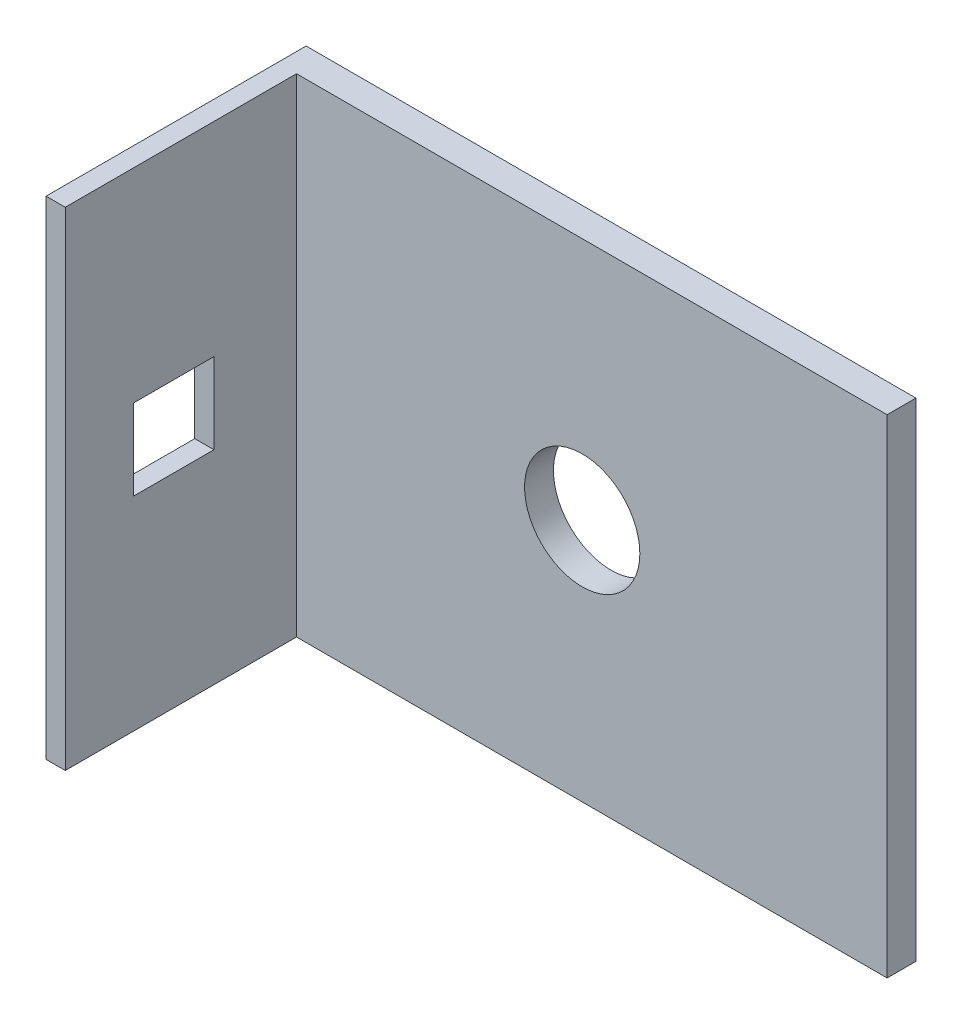
from build123d import *

# Parameters (mm, degrees)
SKETCH1_W           = 63.5
SKETCH1_H           = 50.8
SKETCH1_R           = 6
BOSS_EXTRUDE1_DEPTH = 3
SKETCH2_W           = 2
SKETCH2_H           = 50.8
BOSS_EXTRUDE2_DEPTH = 24.082
SKETCH3_W           = 8.4
SKETCH3_H           = 8.4
CUT_EXTRUDE1_DEPTH  = 2


with BuildPart() as part:
    # Sketch1 → Boss-Extrude1 (new body)
    with BuildSketch(Plane.XY):
        Rectangle(SKETCH1_W, SKETCH1_H)
        Circle(SKETCH1_R, mode=Mode.SUBTRACT)
    extrude(amount=BOSS_EXTRUDE1_DEPTH)

    # Sketch2 → Boss-Extrude2 (add)
    with BuildSketch(Plane.XY.offset(3)):
        with Locations((-30.75, 0)):
            Rectangle(SKETCH2_W, SKETCH2_H)
    extrude(amount=BOSS_EXTRUDE2_DEPTH)

    # Sketch3 → Cut-Extrude1 (cut)
    with BuildSketch(Plane.ZY.offset(31.75)):
        with Locations((15.8, -0.009)):
            Rectangle(SKETCH3_W, SKETCH3_H)
    extrude(amount=-CUT_EXTRUDE1_DEPTH, mode=Mode.SUBTRACT)


solid = part.part
